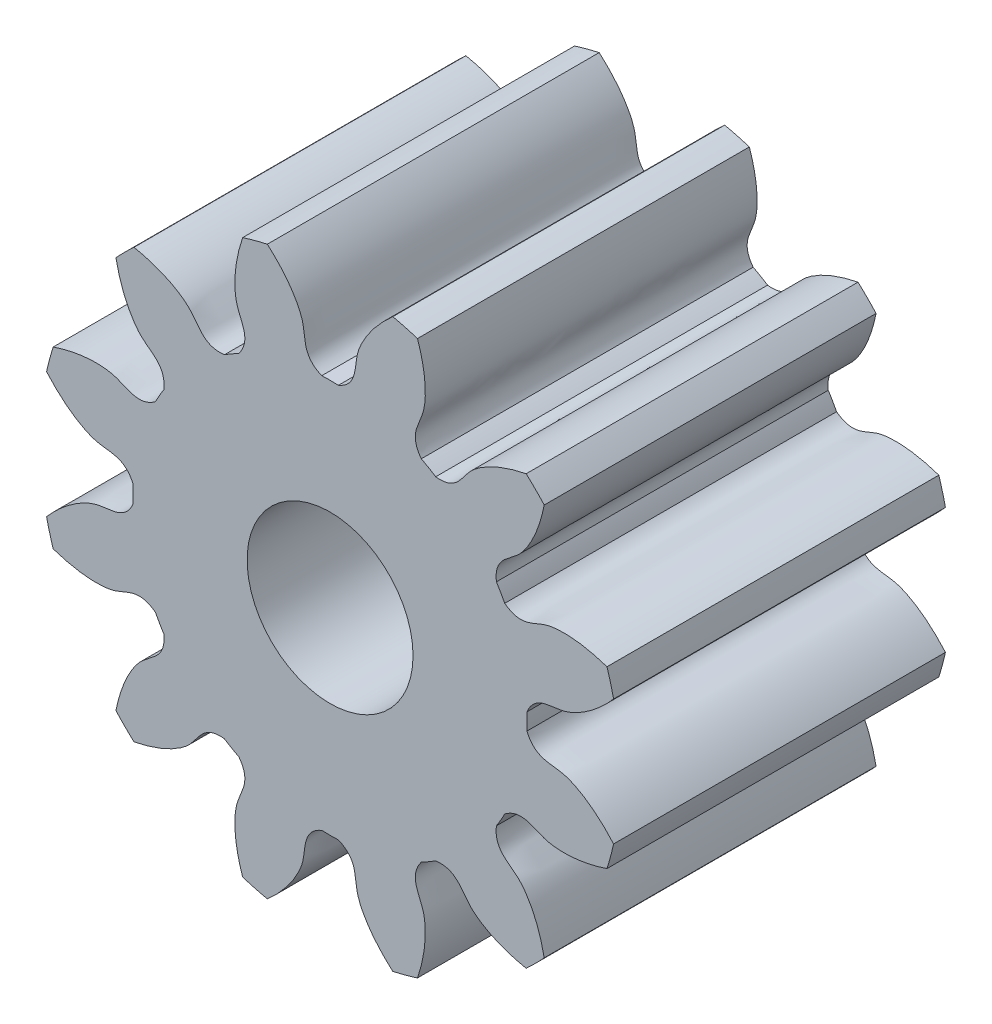
from build123d import *

# Parameters (mm, degrees)
SKETCH_1_R      = 2
EXTRUDE_1_DEPTH = 8


with BuildPart() as part:
    # 草图1 → 凸台-拉伸1 (new body)
    with BuildSketch(Plane.XY):
        with BuildLine():
            ThreePointArc((-264.446064381, -183.321585354), (-264.745065587, -183.394696113), (-265.040563607, -183.480880941))
            add(Edge.make_bspline(
                [(-265.132275695, -185.945814939), (-264.818405548, -185.529556468), (-265.108319589, -185.2402414), (-265.194356847, -184.883191775), (-265.202404652, -184.844546274), (-265.211327015, -184.791149464), (-265.219252344, -184.728488813), (-265.225451334, -184.656572722), (-265.229195441, -184.575453466), (-265.229757813, -184.485226739), (-265.226415959, -184.38603168), (-265.218453985, -184.278050624), (-265.205164911, -184.161508791), (-265.182231956, -184.013267275), (-265.144400105, -183.830624796), (-265.094084276, -183.644562943), (-265.056157382, -183.526617896), (-265.040563607, -183.480880941)],
                knots=[0, 0, 0, 0, 0.218015236, 0.222043642, 0.231522246, 0.24289657, 0.256166614, 0.271332379, 0.288393865, 0.307351072, 0.328203999, 0.350952646, 0.375597015, 0.402137104, 0.445501713, 0.493131694, 0.523595567, 0.523595567, 0.523595567, 0.523595567], degree=3))
            ThreePointArc((-265.132275695, -185.945814939), (-265.308332272, -186.042556229), (-265.480140975, -186.146655051))
            add(Edge.make_bspline(
                [(-267.660692479, -184.993613051), (-267.587842311, -185.008002707), (-267.466955796, -185.035265599), (-267.302627194, -185.080784255), (-267.169447235, -185.123472549), (-267.046554122, -185.16835153), (-266.93389648, -185.214671745), (-266.831379623, -185.261691869), (-266.738866192, -185.308680992), (-266.656176841, -185.35492083), (-266.583091057, -185.399707904), (-266.519348076, -185.442355675), (-266.464647904, -185.482196624), (-266.418652406, -185.518584253), (-266.385837121, -185.546733541), (-266.363637532, -185.567018276), (-266.103163637, -185.814614879), (-265.997566458, -186.210345337), (-265.480140975, -186.146655051)],
                knots=[0.476404433, 0.476404433, 0.476404433, 0.476404433, 0.523218896, 0.554498287, 0.583881957, 0.611369906, 0.636962134, 0.660658643, 0.68245943, 0.702364497, 0.720373843, 0.736487468, 0.750705373, 0.763027557, 0.773454021, 0.777956358, 0.781984764, 1, 1, 1, 1], degree=3))
            ThreePointArc((-267.660692479, -184.993613051), (-267.88307974, -185.206429429), (-268.095896118, -185.428816689))
            add(Edge.make_bspline(
                [(-266.942854117, -187.609368194), (-266.879163831, -187.09194271), (-267.27489429, -186.986345532), (-267.527929553, -186.720150115), (-267.554221908, -186.690706032), (-267.588647306, -186.64892422), (-267.626841167, -186.598621169), (-267.668167696, -186.539439502), (-267.711969816, -186.471060219), (-267.757570207, -186.393202767), (-267.804273606, -186.305626399), (-267.851368863, -186.208131075), (-267.898131104, -186.10055835), (-267.95239134, -185.960710954), (-268.010949236, -185.783622001), (-268.060405375, -185.597329796), (-268.086532245, -185.476222941), (-268.095896118, -185.428816689)],
                knots=[0, 0, 0, 0, 0.218015236, 0.222043642, 0.231522246, 0.24289657, 0.256166614, 0.271332379, 0.288393865, 0.307351072, 0.328203999, 0.350952646, 0.375597015, 0.402137104, 0.445501713, 0.493131694, 0.523595567, 0.523595567, 0.523595567, 0.523595567], degree=3))
            ThreePointArc((-266.942854117, -187.609368194), (-267.04695294, -187.781176897), (-267.14369423, -187.957233473))
            add(Edge.make_bspline(
                [(-269.608628228, -188.048945561), (-269.538343303, -188.024982286), (-269.420021064, -187.988149384), (-269.254948992, -187.945405396), (-269.118267617, -187.915784564), (-268.989399569, -187.893204345), (-268.868675081, -187.876990006), (-268.756382817, -187.8664522), (-268.652769274, -187.860889259), (-268.558038276, -187.859589457), (-268.472350594, -187.861833309), (-268.395823668, -187.866895872), (-268.328531454, -187.87404906), (-268.270504371, -187.882563922), (-268.228010856, -187.890534278), (-268.19864308, -187.89700158), (-267.849267769, -187.98118958), (-267.5599527, -188.271103621), (-267.14369423, -187.957233473)],
                knots=[0.476404433, 0.476404433, 0.476404433, 0.476404433, 0.523218896, 0.554498287, 0.583881957, 0.611369906, 0.636962134, 0.660658643, 0.68245943, 0.702364497, 0.720373843, 0.736487468, 0.750705373, 0.763027557, 0.773454021, 0.777956358, 0.781984764, 1, 1, 1, 1], degree=3))
            ThreePointArc((-269.608628228, -188.048945561), (-269.694813056, -188.344443581), (-269.767923815, -188.643444787))
            add(Edge.make_bspline(
                [(-267.679084398, -189.955336784), (-267.882639734, -189.475388028), (-268.278150954, -189.581803418), (-268.630383628, -189.477789057), (-268.667875517, -189.46543591), (-268.718579693, -189.446464498), (-268.776808072, -189.421997709), (-268.842188729, -189.391408146), (-268.914312119, -189.35409101), (-268.992731942, -189.309464674), (-269.076966457, -189.256973014), (-269.166499807, -189.196087215), (-269.260783458, -189.126307623), (-269.3776979, -189.032326344), (-269.516955001, -188.90824176), (-269.652931377, -188.771636047), (-269.736111337, -188.679817869), (-269.767923815, -188.643444787)],
                knots=[0, 0, 0, 0, 0.218015236, 0.222043642, 0.231522246, 0.24289657, 0.256166614, 0.271332379, 0.288393865, 0.307351072, 0.328203999, 0.350952646, 0.375597015, 0.402137104, 0.445501713, 0.493131694, 0.523595567, 0.523595567, 0.523595567, 0.523595567], degree=3))
            ThreePointArc((-267.679084398, -189.955336784), (-267.683332272, -190.156176897), (-267.679084398, -190.357017009))
            add(Edge.make_bspline(
                [(-269.767923815, -191.668909007), (-269.719036923, -191.613013739), (-269.634983309, -191.521954391), (-269.513398695, -191.402400975), (-269.409839568, -191.308407895), (-269.309526674, -191.224418828), (-269.21308337, -191.150014554), (-269.12110432, -191.084742415), (-269.03415383, -191.028117994), (-268.95276428, -190.979626835), (-268.877434644, -190.938726226), (-268.808629101, -190.904847071), (-268.746775741, -190.877395806), (-268.692265381, -190.855756352), (-268.65147974, -190.841412125), (-268.622812849, -190.832329085), (-268.278150954, -190.730550376), (-267.882639734, -190.836965766), (-267.679084398, -190.357017009)],
                knots=[0.476404433, 0.476404433, 0.476404433, 0.476404433, 0.523218896, 0.554498287, 0.583881957, 0.611369906, 0.636962134, 0.660658643, 0.68245943, 0.702364497, 0.720373843, 0.736487468, 0.750705373, 0.763027557, 0.773454021, 0.777956358, 0.781984764, 1, 1, 1, 1], degree=3))
            ThreePointArc((-269.767923815, -191.668909007), (-269.694813056, -191.967910213), (-269.608628228, -192.263408232))
            add(Edge.make_bspline(
                [(-267.14369423, -192.355120321), (-267.5599527, -192.041250173), (-267.849267769, -192.331164214), (-268.206317393, -192.417201472), (-268.244962894, -192.425249277), (-268.298359705, -192.434171641), (-268.361020355, -192.442096969), (-268.432936446, -192.44829596), (-268.514055703, -192.452040067), (-268.604282429, -192.452602438), (-268.703477489, -192.449260584), (-268.811458544, -192.44129861), (-268.928000377, -192.428009536), (-269.076241893, -192.405076582), (-269.258884373, -192.367244731), (-269.444946225, -192.316928901), (-269.562891273, -192.279002007), (-269.608628228, -192.263408232)],
                knots=[0, 0, 0, 0, 0.218015236, 0.222043642, 0.231522246, 0.24289657, 0.256166614, 0.271332379, 0.288393865, 0.307351072, 0.328203999, 0.350952646, 0.375597015, 0.402137104, 0.445501713, 0.493131694, 0.523595567, 0.523595567, 0.523595567, 0.523595567], degree=3))
            ThreePointArc((-267.14369423, -192.355120321), (-267.04695294, -192.531176897), (-266.942854117, -192.7029856))
            add(Edge.make_bspline(
                [(-268.095896118, -194.883537105), (-268.081506461, -194.810686937), (-268.05424357, -194.689800422), (-268.008724914, -194.52547182), (-267.966036619, -194.392291861), (-267.921157638, -194.269398748), (-267.874837424, -194.156741105), (-267.827817299, -194.054224248), (-267.780828176, -193.961710817), (-267.734588338, -193.879021466), (-267.689801264, -193.805935682), (-267.647153494, -193.742192701), (-267.607312545, -193.687492529), (-267.570924915, -193.641497032), (-267.542775628, -193.608681746), (-267.522490892, -193.586482157), (-267.27489429, -193.326008262), (-266.879163831, -193.220411084), (-266.942854117, -192.7029856)],
                knots=[0.476404433, 0.476404433, 0.476404433, 0.476404433, 0.523218896, 0.554498287, 0.583881957, 0.611369906, 0.636962134, 0.660658643, 0.68245943, 0.702364497, 0.720373843, 0.736487468, 0.750705373, 0.763027557, 0.773454021, 0.777956358, 0.781984764, 1, 1, 1, 1], degree=3))
            ThreePointArc((-268.095896118, -194.883537105), (-267.88307974, -195.105924365), (-267.660692479, -195.318740743))
            add(Edge.make_bspline(
                [(-265.480140975, -194.165698742), (-265.997566458, -194.102008456), (-266.103163637, -194.497738915), (-266.369359053, -194.750774178), (-266.398803136, -194.777066533), (-266.440584949, -194.811491931), (-266.490887999, -194.849685792), (-266.550069666, -194.891012321), (-266.618448949, -194.934814441), (-266.696306401, -194.980414832), (-266.78388277, -195.027118232), (-266.881378093, -195.074213488), (-266.988950819, -195.120975729), (-267.128798215, -195.175235965), (-267.305887167, -195.233793861), (-267.492179373, -195.28325), (-267.613286227, -195.30937687), (-267.660692479, -195.318740743)],
                knots=[0, 0, 0, 0, 0.218015236, 0.222043642, 0.231522246, 0.24289657, 0.256166614, 0.271332379, 0.288393865, 0.307351072, 0.328203999, 0.350952646, 0.375597015, 0.402137104, 0.445501713, 0.493131694, 0.523595567, 0.523595567, 0.523595567, 0.523595567], degree=3))
            ThreePointArc((-265.480140975, -194.165698742), (-265.308332272, -194.269797565), (-265.132275695, -194.366538855))
            add(Edge.make_bspline(
                [(-265.040563607, -196.831472853), (-265.064526883, -196.761187928), (-265.101359784, -196.64286569), (-265.144103773, -196.477793618), (-265.173724605, -196.341112243), (-265.196304823, -196.212244194), (-265.212519162, -196.091519706), (-265.223056968, -195.979227442), (-265.22861991, -195.875613899), (-265.229919711, -195.780882901), (-265.227675859, -195.695195219), (-265.222613296, -195.618668293), (-265.215460109, -195.551376079), (-265.206945246, -195.493348996), (-265.198974891, -195.450855481), (-265.192507589, -195.421487705), (-265.108319589, -195.072112394), (-264.818405548, -194.782797325), (-265.132275695, -194.366538855)],
                knots=[0.476404433, 0.476404433, 0.476404433, 0.476404433, 0.523218896, 0.554498287, 0.583881957, 0.611369906, 0.636962134, 0.660658643, 0.68245943, 0.702364497, 0.720373843, 0.736487468, 0.750705373, 0.763027557, 0.773454021, 0.777956358, 0.781984764, 1, 1, 1, 1], degree=3))
            ThreePointArc((-265.040563607, -196.831472853), (-264.745065587, -196.917657681), (-264.446064381, -196.99076844))
            add(Edge.make_bspline(
                [(-263.134172384, -194.901929024), (-263.614121141, -195.10548436), (-263.50770575, -195.500995579), (-263.611720112, -195.853228253), (-263.624073258, -195.890720142), (-263.64304467, -195.941424318), (-263.66751146, -195.999652697), (-263.698101022, -196.065033354), (-263.735418158, -196.137156744), (-263.780044494, -196.215576567), (-263.832536154, -196.299811082), (-263.893421953, -196.389344432), (-263.963201545, -196.483628084), (-264.057182825, -196.600542525), (-264.181267409, -196.739799626), (-264.317873122, -196.875776002), (-264.409691299, -196.958955963), (-264.446064381, -196.99076844)],
                knots=[0, 0, 0, 0, 0.218015236, 0.222043642, 0.231522246, 0.24289657, 0.256166614, 0.271332379, 0.288393865, 0.307351072, 0.328203999, 0.350952646, 0.375597015, 0.402137104, 0.445501713, 0.493131694, 0.523595567, 0.523595567, 0.523595567, 0.523595567], degree=3))
            ThreePointArc((-263.134172384, -194.901929024), (-262.933332272, -194.906176897), (-262.732492159, -194.901929024))
            add(Edge.make_bspline(
                [(-261.420600162, -196.99076844), (-261.47649543, -196.941881548), (-261.567554777, -196.857827934), (-261.687108193, -196.736243321), (-261.781101273, -196.632684194), (-261.865090341, -196.532371299), (-261.939494614, -196.435927995), (-262.004766754, -196.343948945), (-262.061391174, -196.256998455), (-262.109882334, -196.175608905), (-262.150782942, -196.10027927), (-262.184662097, -196.031473726), (-262.212113362, -195.969620366), (-262.233752816, -195.915110006), (-262.248097043, -195.874324365), (-262.257180084, -195.845657475), (-262.358958793, -195.500995579), (-262.252543402, -195.10548436), (-262.732492159, -194.901929024)],
                knots=[0.476404433, 0.476404433, 0.476404433, 0.476404433, 0.523218896, 0.554498287, 0.583881957, 0.611369906, 0.636962134, 0.660658643, 0.68245943, 0.702364497, 0.720373843, 0.736487468, 0.750705373, 0.763027557, 0.773454021, 0.777956358, 0.781984764, 1, 1, 1, 1], degree=3))
            ThreePointArc((-261.420600162, -196.99076844), (-261.121598956, -196.917657681), (-260.826100936, -196.831472853))
            add(Edge.make_bspline(
                [(-260.734388848, -194.366538855), (-261.048258996, -194.782797325), (-260.758344954, -195.072112394), (-260.672307696, -195.429162018), (-260.664259891, -195.46780752), (-260.655337528, -195.52120433), (-260.647412199, -195.58386498), (-260.641213209, -195.655781072), (-260.637469102, -195.736900328), (-260.636906731, -195.827127054), (-260.640248584, -195.926322114), (-260.648210558, -196.034303169), (-260.661499632, -196.150845003), (-260.684432587, -196.299086519), (-260.722264438, -196.481728998), (-260.772580268, -196.66779085), (-260.810507162, -196.785735898), (-260.826100936, -196.831472853)],
                knots=[0, 0, 0, 0, 0.218015236, 0.222043642, 0.231522246, 0.24289657, 0.256166614, 0.271332379, 0.288393865, 0.307351072, 0.328203999, 0.350952646, 0.375597015, 0.402137104, 0.445501713, 0.493131694, 0.523595567, 0.523595567, 0.523595567, 0.523595567], degree=3))
            ThreePointArc((-260.734388848, -194.366538855), (-260.558332272, -194.269797565), (-260.386523569, -194.165698742))
            add(Edge.make_bspline(
                [(-258.205972064, -195.318740743), (-258.278822232, -195.304351086), (-258.399708747, -195.277088195), (-258.564037349, -195.231569539), (-258.697217308, -195.188881244), (-258.820110421, -195.144002263), (-258.932768064, -195.097682049), (-259.03528492, -195.050661925), (-259.127798352, -195.003672802), (-259.210487703, -194.957432964), (-259.283573486, -194.91264589), (-259.347316467, -194.869998119), (-259.40201664, -194.83015717), (-259.448012137, -194.79376954), (-259.480827422, -194.765620253), (-259.503027011, -194.745335518), (-259.763500906, -194.497738915), (-259.869098085, -194.102008456), (-260.386523569, -194.165698742)],
                knots=[0.476404433, 0.476404433, 0.476404433, 0.476404433, 0.523218896, 0.554498287, 0.583881957, 0.611369906, 0.636962134, 0.660658643, 0.68245943, 0.702364497, 0.720373843, 0.736487468, 0.750705373, 0.763027557, 0.773454021, 0.777956358, 0.781984764, 1, 1, 1, 1], degree=3))
            ThreePointArc((-258.205972064, -195.318740743), (-257.983584803, -195.105924365), (-257.770768426, -194.883537105))
            add(Edge.make_bspline(
                [(-258.923810426, -192.7029856), (-258.987500712, -193.220411084), (-258.591770253, -193.326008262), (-258.33873499, -193.592203678), (-258.312442636, -193.621647761), (-258.278017237, -193.663429574), (-258.239823376, -193.713732625), (-258.198496847, -193.772914292), (-258.154694727, -193.841293575), (-258.109094337, -193.919151026), (-258.062390937, -194.006727395), (-258.015295681, -194.104222719), (-257.96853344, -194.211795444), (-257.914273203, -194.35164284), (-257.855715308, -194.528731792), (-257.806259168, -194.715023998), (-257.780132298, -194.836130853), (-257.770768426, -194.883537105)],
                knots=[0, 0, 0, 0, 0.218015236, 0.222043642, 0.231522246, 0.24289657, 0.256166614, 0.271332379, 0.288393865, 0.307351072, 0.328203999, 0.350952646, 0.375597015, 0.402137104, 0.445501713, 0.493131694, 0.523595567, 0.523595567, 0.523595567, 0.523595567], degree=3))
            ThreePointArc((-258.923810426, -192.7029856), (-258.819711604, -192.531176897), (-258.722970313, -192.355120321))
            add(Edge.make_bspline(
                [(-256.258036316, -192.263408232), (-256.32832124, -192.287371508), (-256.446643479, -192.324204409), (-256.611715551, -192.366948398), (-256.748396926, -192.39656923), (-256.877264974, -192.419149448), (-256.997989462, -192.435363787), (-257.110281726, -192.445901594), (-257.21389527, -192.451464535), (-257.308626267, -192.452764336), (-257.394313949, -192.450520484), (-257.470840875, -192.445457922), (-257.538133089, -192.438304734), (-257.596160173, -192.429789871), (-257.638653687, -192.421819516), (-257.668021463, -192.415352214), (-258.017396775, -192.331164214), (-258.306711843, -192.041250173), (-258.722970313, -192.355120321)],
                knots=[0.476404433, 0.476404433, 0.476404433, 0.476404433, 0.523218896, 0.554498287, 0.583881957, 0.611369906, 0.636962134, 0.660658643, 0.68245943, 0.702364497, 0.720373843, 0.736487468, 0.750705373, 0.763027557, 0.773454021, 0.777956358, 0.781984764, 1, 1, 1, 1], degree=3))
            ThreePointArc((-256.258036316, -192.263408232), (-256.171851488, -191.967910213), (-256.098740728, -191.668909007))
            add(Edge.make_bspline(
                [(-258.187580145, -190.357017009), (-257.984024809, -190.836965766), (-257.588513589, -190.730550376), (-257.236280915, -190.834564737), (-257.198789027, -190.846917884), (-257.148084851, -190.865889296), (-257.089856471, -190.890356085), (-257.024475814, -190.920945647), (-256.952352424, -190.958262784), (-256.873932601, -191.002889119), (-256.789698086, -191.055380779), (-256.700164736, -191.116266578), (-256.605881085, -191.186046171), (-256.488966644, -191.28002745), (-256.349709542, -191.404112034), (-256.213733166, -191.540717747), (-256.130553206, -191.632535924), (-256.098740728, -191.668909007)],
                knots=[0, 0, 0, 0, 0.218015236, 0.222043642, 0.231522246, 0.24289657, 0.256166614, 0.271332379, 0.288393865, 0.307351072, 0.328203999, 0.350952646, 0.375597015, 0.402137104, 0.445501713, 0.493131694, 0.523595567, 0.523595567, 0.523595567, 0.523595567], degree=3))
            ThreePointArc((-258.187580145, -190.357017009), (-258.183332272, -190.156176897), (-258.187580145, -189.955336784))
            add(Edge.make_bspline(
                [(-256.098740728, -188.643444787), (-256.147627621, -188.699340055), (-256.231681234, -188.790399402), (-256.353265848, -188.909952818), (-256.456824975, -189.003945899), (-256.557137869, -189.087934966), (-256.653581173, -189.162339239), (-256.745560223, -189.227611379), (-256.832510713, -189.2842358), (-256.913900263, -189.332726959), (-256.989229899, -189.373627567), (-257.058035442, -189.407506723), (-257.119888802, -189.434957987), (-257.174399162, -189.456597442), (-257.215184803, -189.470941669), (-257.243851694, -189.480024709), (-257.588513589, -189.581803418), (-257.984024809, -189.475388028), (-258.187580145, -189.955336784)],
                knots=[0.476404433, 0.476404433, 0.476404433, 0.476404433, 0.523218896, 0.554498287, 0.583881957, 0.611369906, 0.636962134, 0.660658643, 0.68245943, 0.702364497, 0.720373843, 0.736487468, 0.750705373, 0.763027557, 0.773454021, 0.777956358, 0.781984764, 1, 1, 1, 1], degree=3))
            ThreePointArc((-256.098740728, -188.643444787), (-256.171851488, -188.344443581), (-256.258036316, -188.048945561))
            add(Edge.make_bspline(
                [(-258.722970313, -187.957233473), (-258.306711843, -188.271103621), (-258.017396775, -187.98118958), (-257.66034715, -187.895152322), (-257.621701649, -187.887104516), (-257.568304838, -187.878182153), (-257.505644188, -187.870256824), (-257.433728097, -187.864057834), (-257.352608841, -187.860313727), (-257.262382114, -187.859751356), (-257.163187054, -187.86309321), (-257.055205999, -187.871055183), (-256.938664166, -187.884344257), (-256.79042265, -187.907277212), (-256.60778017, -187.945109063), (-256.421718318, -187.995424893), (-256.303773271, -188.033351787), (-256.258036316, -188.048945561)],
                knots=[0, 0, 0, 0, 0.218015236, 0.222043642, 0.231522246, 0.24289657, 0.256166614, 0.271332379, 0.288393865, 0.307351072, 0.328203999, 0.350952646, 0.375597015, 0.402137104, 0.445501713, 0.493131694, 0.523595567, 0.523595567, 0.523595567, 0.523595567], degree=3))
            ThreePointArc((-258.722970313, -187.957233473), (-258.819711604, -187.781176897), (-258.923810426, -187.609368194))
            add(Edge.make_bspline(
                [(-257.770768426, -185.428816689), (-257.785158082, -185.501666857), (-257.812420973, -185.622553372), (-257.857939629, -185.786881974), (-257.900627924, -185.920061933), (-257.945506905, -186.042955046), (-257.99182712, -186.155612689), (-258.038847244, -186.258129545), (-258.085836367, -186.350642977), (-258.132076205, -186.433332328), (-258.176863279, -186.506418111), (-258.21951105, -186.570161092), (-258.259351999, -186.624861265), (-258.295739628, -186.670856762), (-258.323888916, -186.703672048), (-258.344173651, -186.725871636), (-258.591770253, -186.986345532), (-258.987500712, -187.09194271), (-258.923810426, -187.609368194)],
                knots=[0.476404433, 0.476404433, 0.476404433, 0.476404433, 0.523218896, 0.554498287, 0.583881957, 0.611369906, 0.636962134, 0.660658643, 0.68245943, 0.702364497, 0.720373843, 0.736487468, 0.750705373, 0.763027557, 0.773454021, 0.777956358, 0.781984764, 1, 1, 1, 1], degree=3))
            ThreePointArc((-257.770768426, -185.428816689), (-257.983584803, -185.206429429), (-258.205972064, -184.993613051))
            add(Edge.make_bspline(
                [(-260.386523569, -186.146655051), (-259.869098085, -186.210345337), (-259.763500906, -185.814614879), (-259.49730549, -185.561579615), (-259.467861407, -185.535287261), (-259.426079594, -185.500861862), (-259.375776544, -185.462668001), (-259.316594877, -185.421341472), (-259.248215594, -185.377539353), (-259.170358142, -185.331938962), (-259.082781774, -185.285235562), (-258.98528645, -185.238140306), (-258.877713725, -185.191378065), (-258.737866328, -185.137117828), (-258.560777376, -185.078559933), (-258.37448517, -185.029103793), (-258.253378316, -185.002976923), (-258.205972064, -184.993613051)],
                knots=[0, 0, 0, 0, 0.218015236, 0.222043642, 0.231522246, 0.24289657, 0.256166614, 0.271332379, 0.288393865, 0.307351072, 0.328203999, 0.350952646, 0.375597015, 0.402137104, 0.445501713, 0.493131694, 0.523595567, 0.523595567, 0.523595567, 0.523595567], degree=3))
            ThreePointArc((-260.386523569, -186.146655051), (-260.558332272, -186.042556229), (-260.734388848, -185.945814939))
            add(Edge.make_bspline(
                [(-260.826100936, -183.480880941), (-260.80213766, -183.551165865), (-260.765304759, -183.669488104), (-260.722560771, -183.834560176), (-260.692939939, -183.971241551), (-260.67035972, -184.1001096), (-260.654145381, -184.220834087), (-260.643607575, -184.333126351), (-260.638044633, -184.436739895), (-260.636744832, -184.531470892), (-260.638988684, -184.617158575), (-260.644051247, -184.693685501), (-260.651204434, -184.760977714), (-260.659719297, -184.819004798), (-260.667689653, -184.861498313), (-260.674156954, -184.890866088), (-260.758344954, -185.2402414), (-261.048258996, -185.529556468), (-260.734388848, -185.945814939)],
                knots=[0.476404433, 0.476404433, 0.476404433, 0.476404433, 0.523218896, 0.554498287, 0.583881957, 0.611369906, 0.636962134, 0.660658643, 0.68245943, 0.702364497, 0.720373843, 0.736487468, 0.750705373, 0.763027557, 0.773454021, 0.777956358, 0.781984764, 1, 1, 1, 1], degree=3))
            ThreePointArc((-260.826100936, -183.480880941), (-261.121598956, -183.394696113), (-261.420600162, -183.321585354))
            add(Edge.make_bspline(
                [(-262.732492159, -185.41042477), (-262.252543402, -185.206869434), (-262.358958793, -184.811358214), (-262.254944432, -184.45912554), (-262.242591285, -184.421633652), (-262.223619873, -184.370929476), (-262.199153084, -184.312701096), (-262.168563521, -184.247320439), (-262.131246385, -184.175197049), (-262.086620049, -184.096777226), (-262.034128389, -184.012542712), (-261.97324259, -183.923009361), (-261.903462998, -183.82872571), (-261.809481718, -183.711811269), (-261.685397135, -183.572554167), (-261.548791422, -183.436577792), (-261.456973244, -183.353397831), (-261.420600162, -183.321585354)],
                knots=[0, 0, 0, 0, 0.218015236, 0.222043642, 0.231522246, 0.24289657, 0.256166614, 0.271332379, 0.288393865, 0.307351072, 0.328203999, 0.350952646, 0.375597015, 0.402137104, 0.445501713, 0.493131694, 0.523595567, 0.523595567, 0.523595567, 0.523595567], degree=3))
            ThreePointArc((-262.732492159, -185.41042477), (-262.933332272, -185.406176897), (-263.134172384, -185.41042477))
            add(Edge.make_bspline(
                [(-264.446064381, -183.321585354), (-264.390169114, -183.370472246), (-264.299109766, -183.45452586), (-264.17955635, -183.576110473), (-264.08556327, -183.6796696), (-264.001574203, -183.779982495), (-263.927169929, -183.876425798), (-263.861897789, -183.968404849), (-263.805273369, -184.055355339), (-263.756782209, -184.136744888), (-263.715881601, -184.212074524), (-263.682002446, -184.280880067), (-263.654551181, -184.342733428), (-263.632911727, -184.397243788), (-263.6185675, -184.438029429), (-263.60948446, -184.466696319), (-263.50770575, -184.811358214), (-263.614121141, -185.206869434), (-263.134172384, -185.41042477)],
                knots=[0.476404433, 0.476404433, 0.476404433, 0.476404433, 0.523218896, 0.554498287, 0.583881957, 0.611369906, 0.636962134, 0.660658643, 0.68245943, 0.702364497, 0.720373843, 0.736487468, 0.750705373, 0.763027557, 0.773454021, 0.777956358, 0.781984764, 1, 1, 1, 1], degree=3))
        make_face()
        with Locations((-262.933332272, -190.156176897)):
            Circle(SKETCH_1_R, mode=Mode.SUBTRACT)
    extrude(amount=EXTRUDE_1_DEPTH)


solid = part.part
